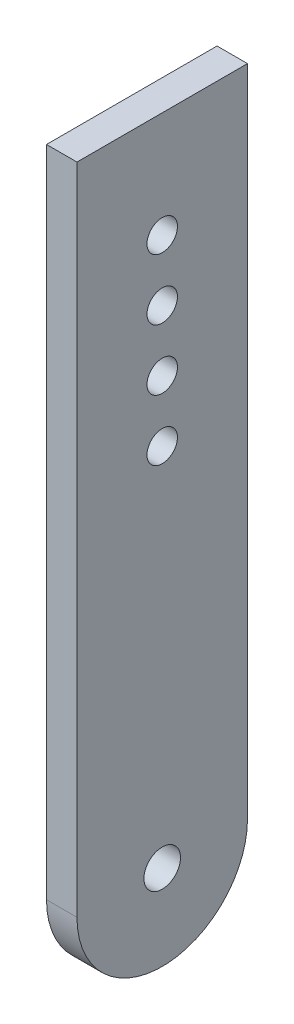
from build123d import *

# Parameters (mm, degrees)
SKETCH1_R           = 1.5
SKETCH1_R_2         = 1.25
BOSS_EXTRUDE1_DEPTH = 2.5


with BuildPart() as part:
    # Sketch1 → Boss-Extrude1 (new body)
    with BuildSketch(Plane(origin=(0, 0, 0), x_dir=(0, 0, -1), z_dir=(1, 0, 0))):
        with BuildLine():
            Line((-7, 0), (-7, 53.695339599))
            Line((-7, 53.695339599), (7, 53.695339599))
            Line((7, 53.695339599), (7, 0))
            ThreePointArc((7, 0), (0, -7), (-7, 0))
        make_face()
        Circle(SKETCH1_R, mode=Mode.SUBTRACT)
        with Locations((0, 45)):
            Circle(SKETCH1_R_2, mode=Mode.SUBTRACT)
        with Locations((0, 40)):
            Circle(SKETCH1_R_2, mode=Mode.SUBTRACT)
        with Locations((0, 35)):
            Circle(SKETCH1_R_2, mode=Mode.SUBTRACT)
        with Locations((0, 30)):
            Circle(SKETCH1_R_2, mode=Mode.SUBTRACT)
    extrude(amount=BOSS_EXTRUDE1_DEPTH)


solid = part.part
